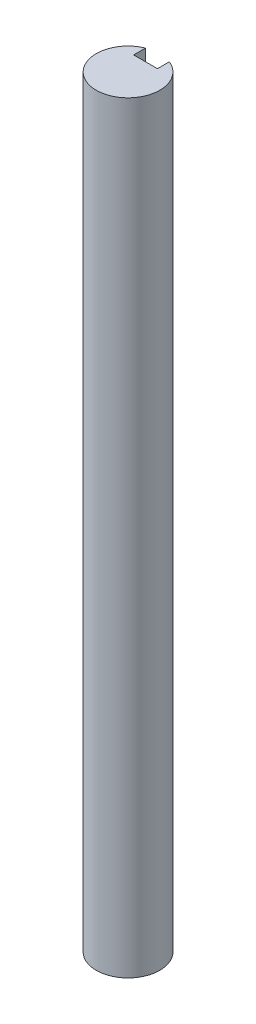
from build123d import *

# Parameters (mm, degrees)
BOSS_EXTRUDE1_DEPTH = 76.2


with BuildPart() as part:
    # Sketch1 → Boss-Extrude1 (new body)
    with BuildSketch(Plane(origin=(0, 0, 0), x_dir=(1, 0, 0), z_dir=(0, 1, 0))):
        with BuildLine():
            Line((-1.190625, 2.943303775), (-1.190625, 1.752678775))
            Line((-1.190625, 1.752678775), (1.190625, 1.752678775))
            Line((1.190625, 1.752678775), (1.190625, 2.943303775))
            ThreePointArc((1.190625, 2.943303775), (0, -3.175), (-1.190625, 2.943303775))
        make_face()
    extrude(amount=BOSS_EXTRUDE1_DEPTH)


solid = part.part
